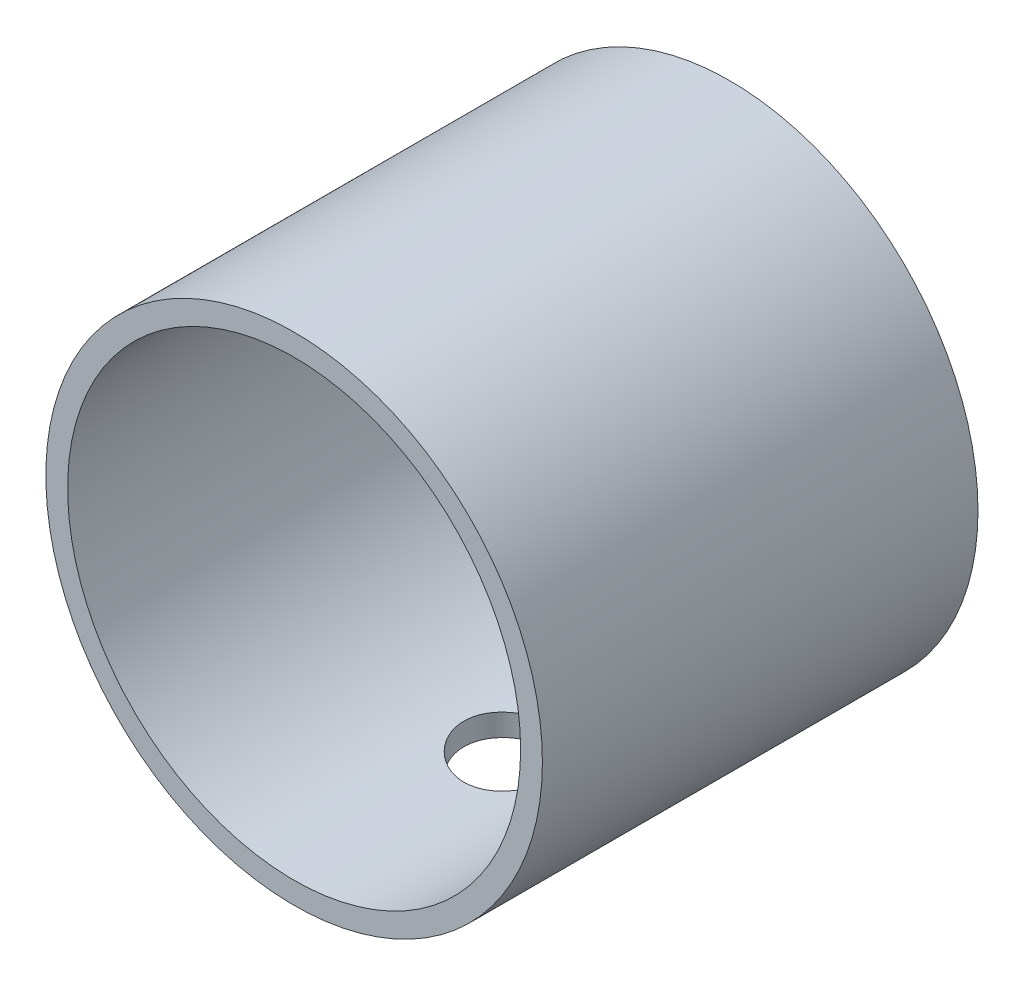
from build123d import *

# Parameters (mm, degrees)
SKETCH1_R           = 28.5
SKETCH1_R_2         = 26
BOSS_EXTRUDE1_DEPTH = 50
SKETCH2_R           = 5.5
CUT_EXTRUDE1_DEPTH  = 50


with BuildPart() as part:
    # Sketch1 → Boss-Extrude1 (new body)
    with BuildSketch(Plane.XY):
        Circle(SKETCH1_R)
        Circle(SKETCH1_R_2, mode=Mode.SUBTRACT)
    extrude(amount=BOSS_EXTRUDE1_DEPTH)

    # Sketch2 → Cut-Extrude1 (cut)
    with BuildSketch(Plane(origin=(0, 0, 0), x_dir=(1, 0, 0), z_dir=(0, 1, 0))):
        with Locations(Location((0, -25, 0), (0, 0, 270))):
            Circle(SKETCH2_R)
    extrude(amount=-CUT_EXTRUDE1_DEPTH, mode=Mode.SUBTRACT)


solid = part.part
